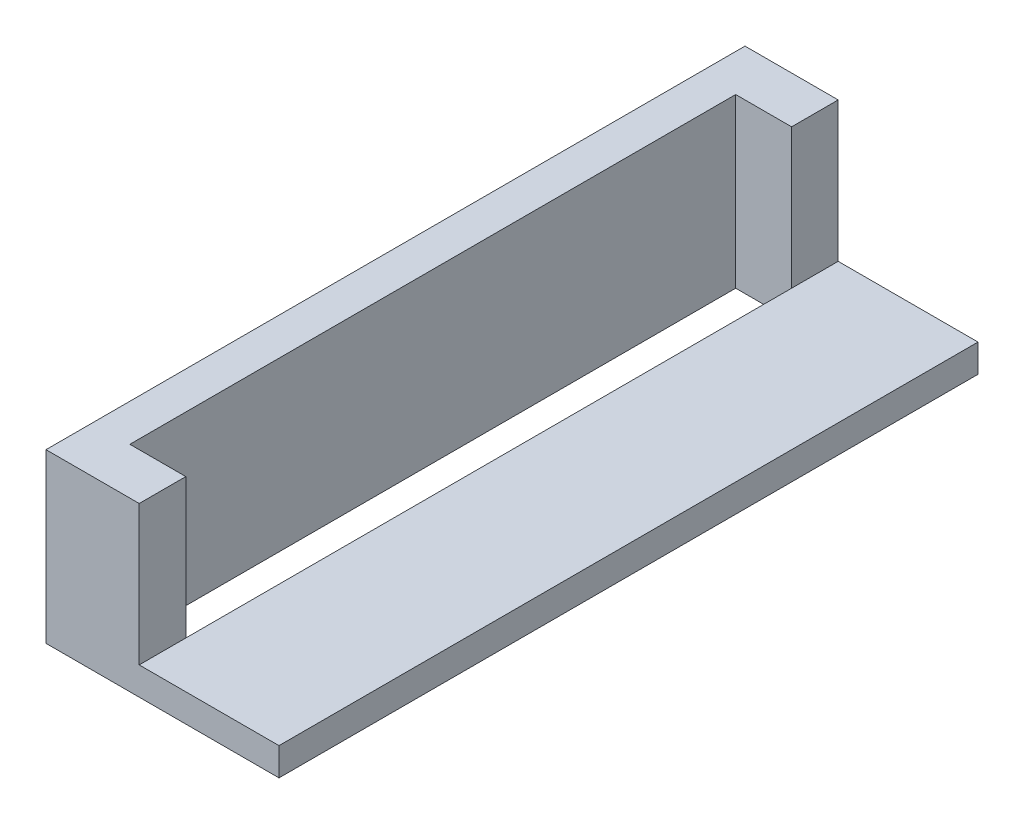
from build123d import *

# Parameters (mm, degrees)
ESBO_O1_W                = 5
ESBO_O1_H                = 15
RESSALTO_EXTRUS_O1_DEPTH = 3.6
ESBO_O2_W                = 3
ESBO_O2_H                = 15
CORTE_EXTRUS_O2_DEPTH    = 3
ESBO_O3_W                = 1.2
ESBO_O3_H                = 13
CORTE_EXTRUS_O3_DEPTH    = 17.21604144


with BuildPart() as part:
    # Esboço1 → Ressalto-extrusão1 (new body)
    with BuildSketch(Plane(origin=(0, 0, 0), x_dir=(1, 0, 0), z_dir=(0, 1, 0))):
        with Locations((-2.5, 7.5)):
            Rectangle(ESBO_O1_W, ESBO_O1_H)
    extrude(amount=RESSALTO_EXTRUS_O1_DEPTH)

    # Esboço2 → Corte-extrusão2 (cut)
    with BuildSketch(Plane(origin=(0, 3.6, 0), x_dir=(1, 0, 0), z_dir=(0, 1, 0))):
        with Locations((-1.5, 7.5)):
            Rectangle(ESBO_O2_W, ESBO_O2_H)
    extrude(amount=-CORTE_EXTRUS_O2_DEPTH, mode=Mode.SUBTRACT)

    # Esboço3 → Corte-extrusão3 (cut, through all)
    with BuildSketch(Plane(origin=(0, 3.6, 0), x_dir=(1, 0, 0), z_dir=(0, 1, 0))):
        with Locations((-3.6, 7.5)):
            Rectangle(ESBO_O3_W, ESBO_O3_H)
    extrude(amount=-CORTE_EXTRUS_O3_DEPTH, mode=Mode.SUBTRACT)


solid = part.part
